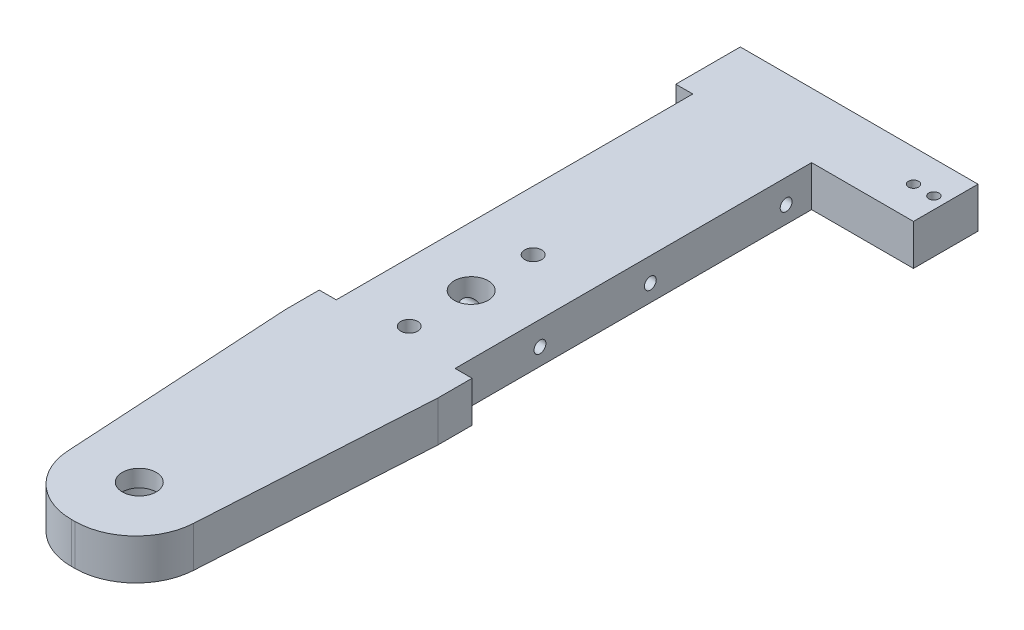
from build123d import *

# Parameters (mm, degrees)
SKETCH1_W           = 45
SKETCH1_H           = 250
BOSS_EXTRUDE1_DEPTH = 12
SKETCH2_R           = 2.5
SKETCH2_R_2         = 5
SKETCH2_W           = 5
SKETCH2_H           = 105
SKETCH2_W_2         = 45
SKETCH2_H_2         = 15
CUT_EXTRUDE1_DEPTH  = 12
SKETCH3_R           = 1.75
CUT_EXTRUDE2_DEPTH  = 35
SKETCH4_W           = 25
SKETCH4_H           = 12
BOSS_EXTRUDE2_DEPTH = 12
SKETCH5_W           = 45
SKETCH5_H           = 23
CUT_EXTRUDE3_DEPTH  = 20
SKETCH6_W           = 70
SKETCH6_H           = 7
BOSS_EXTRUDE3_DEPTH = 12
SKETCH7_R           = 1.5
CUT_EXTRUDE4_DEPTH  = 12
CUT_EXTRUDE5_DEPTH  = 20
FILLET1_R           = 18
SKETCH9_R           = 11
CUT_EXTRUDE6_DEPTH  = 7


with BuildPart() as part:
    # Sketch1 → Boss-Extrude1 (new body)
    with BuildSketch(Plane(origin=(0, 0, 0), x_dir=(1, 0, 0), z_dir=(0, 1, 0))):
        Rectangle(SKETCH1_W, SKETCH1_H)
    extrude(amount=BOSS_EXTRUDE1_DEPTH)

    # Sketch2 → Cut-Extrude1 (cut)
    with BuildSketch(Plane(origin=(0, 12, 0), x_dir=(1, 0, 0), z_dir=(0, 1, 0))):
        with Locations(Location((0, 12, 0), (0, 0, 270))):
            Circle(SKETCH2_R)
        with Locations(Location((0, 30.25, 0), (0, 0, 270))):
            Circle(SKETCH2_R_2)
        with Locations(Location((0, 48.5, 0), (0, 0, 270))):
            Circle(SKETCH2_R)
        with Locations(Location((0, -67.5, 0), (0, 0, 270))):
            Circle(SKETCH2_R_2)
        with Locations((20, 60.5)):
            Rectangle(SKETCH2_W, SKETCH2_H)
        with Locations((-20, 60.5)):
            Rectangle(SKETCH2_W, SKETCH2_H)
        with Locations((0, -117.5)):
            Rectangle(SKETCH2_W_2, SKETCH2_H_2)
    extrude(amount=-CUT_EXTRUDE1_DEPTH, mode=Mode.SUBTRACT)

    # Sketch3 → Cut-Extrude2 (cut)
    with BuildSketch(Plane(origin=(17.5, 0, 0), x_dir=(0, 0, -1), z_dir=(1, 0, 0))):
        with Locations((33, 5)):
            Circle(SKETCH3_R)
        with Locations((65.5, 5)):
            Circle(SKETCH3_R)
        with Locations((105.5, 5)):
            Circle(SKETCH3_R)
    extrude(amount=-CUT_EXTRUDE2_DEPTH, mode=Mode.SUBTRACT)

    # Sketch4 → Boss-Extrude2 (add)
    with BuildSketch(Plane(origin=(0, 12, 0), x_dir=(1, 0, 0), z_dir=(0, 1, 0))):
        with Locations((35, 119)):
            Rectangle(SKETCH4_W, SKETCH4_H)
    extrude(amount=-BOSS_EXTRUDE2_DEPTH)

    # Sketch5 → Cut-Extrude3 (cut)
    with BuildSketch(Plane(origin=(0, 12, 0), x_dir=(1, 0, 0), z_dir=(0, 1, 0))):
        with Locations((0, -98.5)):
            Rectangle(SKETCH5_W, SKETCH5_H)
    extrude(amount=-CUT_EXTRUDE3_DEPTH, mode=Mode.SUBTRACT)

    # Sketch6 → Boss-Extrude3 (add)
    with BuildSketch(Plane(origin=(0, 12, 0), x_dir=(1, 0, 0), z_dir=(0, 1, 0))):
        with Locations((12.5, 128.5)):
            Rectangle(SKETCH6_W, SKETCH6_H)
    extrude(amount=-BOSS_EXTRUDE3_DEPTH)

    # Sketch7 → Cut-Extrude4 (cut)
    with BuildSketch(Plane(origin=(0, 12, 0), x_dir=(1, 0, 0), z_dir=(0, 1, 0))):
        with Locations(Location((38, 122.5, 0), (0, 0, 270))):
            Circle(SKETCH7_R)
        with Locations(Location((44, 122.5, 0), (0, 0, 270))):
            Circle(SKETCH7_R)
    extrude(amount=-CUT_EXTRUDE4_DEPTH, mode=Mode.SUBTRACT)

    # Sketch8 → Cut-Extrude5 (cut)
    with BuildSketch(Plane(origin=(0, 12, 0), x_dir=(1, 0, 0), z_dir=(0, 1, 0))):
        Polygon((-22.5, -2), (-22.5, -87), (-17.5, -87), align=None)
        Polygon((17.5, -87), (22.5, -2), (22.5, -87), align=None)
    extrude(amount=-CUT_EXTRUDE5_DEPTH, mode=Mode.SUBTRACT)

    # Fillet1
    fillet1_edges = [part.edges().sort_by_distance(p)[0] for p in [
        (17.5, 6, 87),
        (-17.5, 6, 87),
    ]]
    fillet(fillet1_edges, radius=FILLET1_R)

    # Sketch9 → Cut-Extrude6 (cut)
    with BuildSketch(Plane.XZ):
        with Locations(Location((0, 67.5, 0), (0, 0, 270))):
            Circle(SKETCH9_R)
    extrude(amount=-CUT_EXTRUDE6_DEPTH, mode=Mode.SUBTRACT)


solid = part.part
